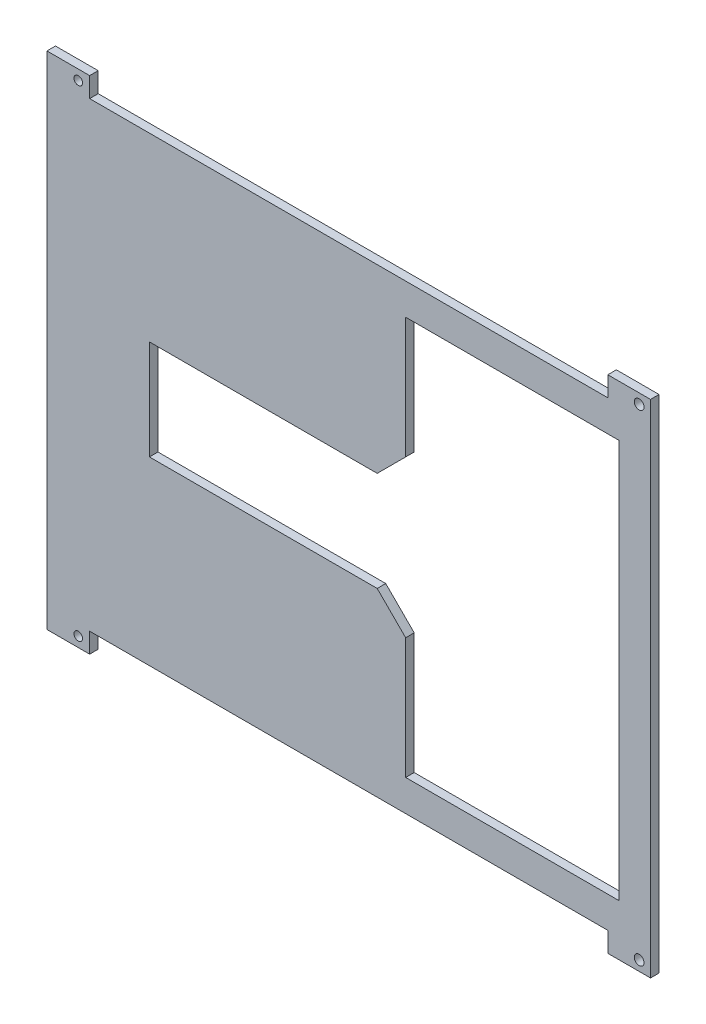
from build123d import *

# Parameters (mm, degrees)
SKETCH1_W           = 15
SKETCH1_H           = 7
SKETCH1_R           = 1.5
SKETCH1_R_2         = 1.715572335
BOSS_EXTRUDE1_DEPTH = 3
CHAMFER1_SIZE       = 10


with BuildPart() as part:
    # Sketch1 → Boss-Extrude1 (new body)
    # profile 1 of 5: a face of its own
    with BuildSketch(Plane.XY):
        Polygon((15, 162), (0, 162), (0, 0), (15, 0), (197, 0), (212, 0), (212, 162), (197, 162), align=None)
        Polygon((126, 151), (201, 151), (201, 11), (126, 11), (126, 63.5), (36, 63.5), (36, 98.5), (126, 98.5), align=None, mode=Mode.SUBTRACT)
    # profile 2 of 5: a face of its own
    with BuildSketch(Plane.XY):
        with Locations((7.5, 165.5)):
            Rectangle(SKETCH1_W, SKETCH1_H)
        with Locations((11, 165.5)):
            Circle(SKETCH1_R, mode=Mode.SUBTRACT)
    # profile 3 of 5: a face of its own
    with BuildSketch(Plane.XY):
        with Locations((7.5, -3.5)):
            Rectangle(SKETCH1_W, SKETCH1_H)
        with Locations((11, -3.5)):
            Circle(SKETCH1_R, mode=Mode.SUBTRACT)
    # profile 4 of 5: a face of its own
    with BuildSketch(Plane.XY):
        with Locations((204.5, -3.5)):
            Rectangle(SKETCH1_W, SKETCH1_H)
        with Locations((208, -3.5)):
            Circle(SKETCH1_R_2, mode=Mode.SUBTRACT)
    # profile 5 of 5: a face of its own
    with BuildSketch(Plane.XY):
        with Locations((204.5, 165.5)):
            Rectangle(SKETCH1_W, SKETCH1_H)
        with Locations((208, 165.5)):
            Circle(SKETCH1_R_2, mode=Mode.SUBTRACT)
    extrude(amount=BOSS_EXTRUDE1_DEPTH)

    # Chamfer1
    chamfer1_edges = [part.edges().sort_by_distance(p)[0] for p in [
        (126, 98.5, 1.5),
        (126, 63.5, 1.5),
    ]]
    chamfer(chamfer1_edges, length=CHAMFER1_SIZE)


solid = part.part
